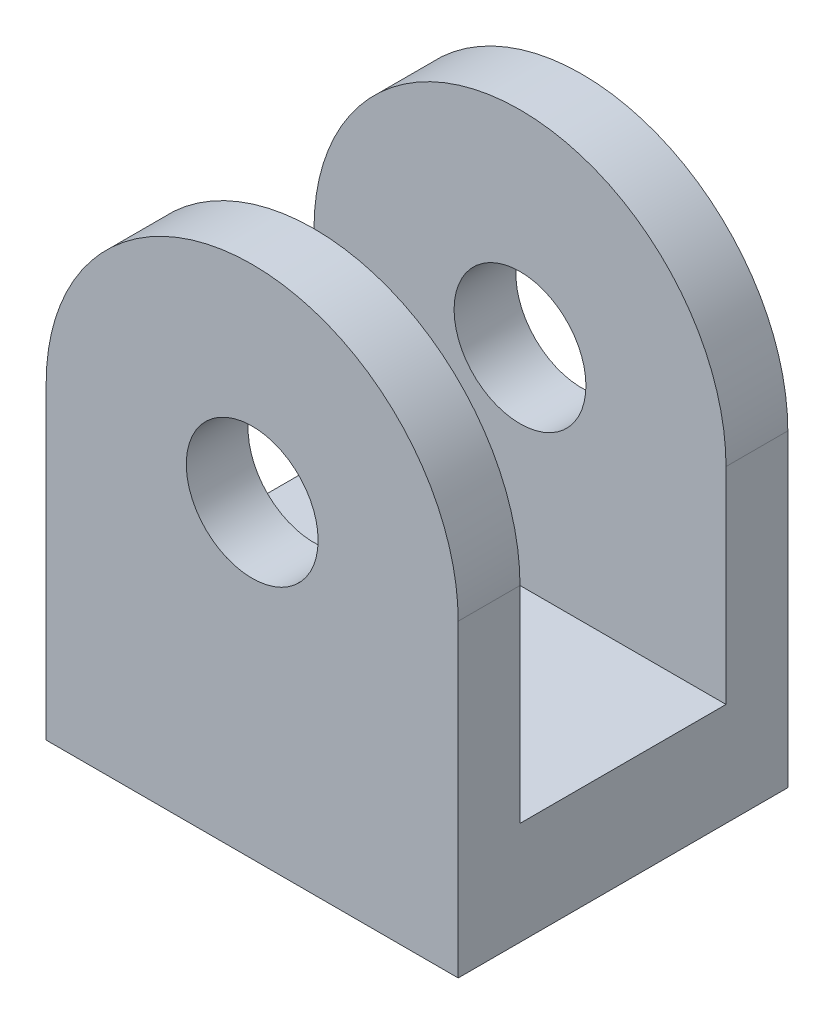
from build123d import *

# Parameters (mm, degrees)
SKETCH_2_W          = 10
SKETCH_2_H          = 8
EXTRUDE_1_DEPTH     = 12.5
SKETCH_3_W          = 10
SKETCH_3_H          = 5
CUT_EXTRUDE_1_DEPTH = 10
SKETCH_4_R          = 1.6
CUT_EXTRUDE_2_DEPTH = 18.895530168
SKETCH_5_OUTSIDE_W  = 15.58
SKETCH_5_OUTSIDE_H  = 18.08
CUT_EXTRUDE_3_DEPTH = 18.895530168


with BuildPart() as part:
    # ｽｹｯﾁ2 → ﾎﾞｽ - 押し出し1 (new body)
    with BuildSketch(Plane(origin=(0, 0, 0), x_dir=(1, 0, 0), z_dir=(0, 1, 0))):
        with Locations((5, 4)):
            Rectangle(SKETCH_2_W, SKETCH_2_H)
    extrude(amount=EXTRUDE_1_DEPTH)

    # ｽｹｯﾁ3 → ｶｯﾄ - 押し出し1 (cut)
    with BuildSketch(Plane(origin=(0, 12.5, 0), x_dir=(1, 0, 0), z_dir=(0, 1, 0))):
        with Locations((5, 4)):
            Rectangle(SKETCH_3_W, SKETCH_3_H)
    extrude(amount=-CUT_EXTRUDE_1_DEPTH, mode=Mode.SUBTRACT)

    # ｽｹｯﾁ4 → ｶｯﾄ - 押し出し2 (cut, through all)
    with BuildSketch(Plane.XY):
        with Locations((5, 7.5)):
            Circle(SKETCH_4_R)
    extrude(amount=-CUT_EXTRUDE_2_DEPTH, mode=Mode.SUBTRACT)

    # ｽｹｯﾁ5 outside → ｶｯﾄ - 押し出し3 (cut, through all)
    with BuildSketch(Plane.XY):
        with Locations((5, 6.25)):
            Rectangle(SKETCH_5_OUTSIDE_W, SKETCH_5_OUTSIDE_H)
        with BuildLine():
            Line((0, 7.5), (0, 0))
            Line((0, 0), (10, 0))
            Line((10, 0), (10, 7.5))
            ThreePointArc((10, 7.5), (5, 12.5), (0, 7.5))
        make_face(mode=Mode.SUBTRACT)
    extrude(amount=-CUT_EXTRUDE_3_DEPTH, mode=Mode.SUBTRACT)


solid = part.part
